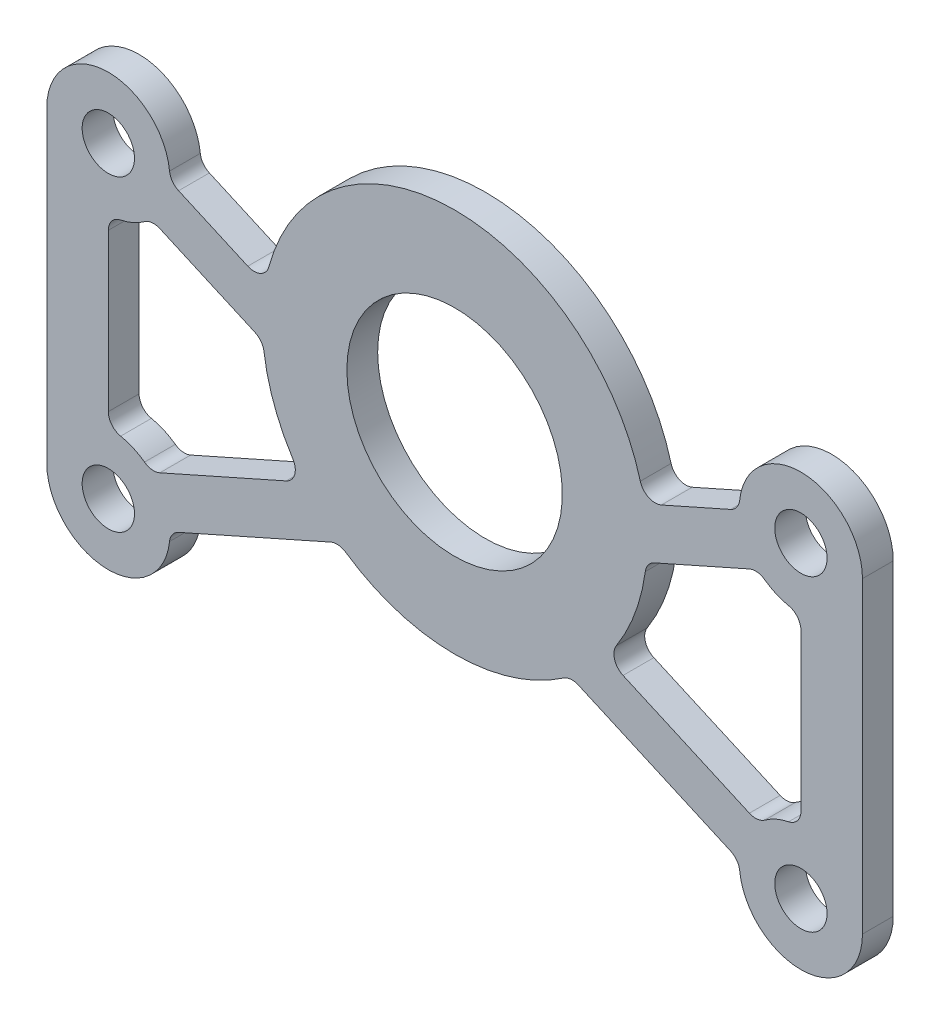
from build123d import *

# Parameters (mm, degrees)
SKETCH_1_R          = 12.5
EXTRUDE_1_DEPTH     = 2
SKETCH_1_R_2        = 4
EXTRUDE_1_2_DEPTH   = 2
EXTRUDE_1_3_DEPTH   = 2
EXTRUDE_1_4_DEPTH   = 2
EXTRUDE_1_5_DEPTH   = 2
EXTRUDE_2_DEPTH     = 2
EXTRUDE_3_DEPTH     = 2
FILLET_1_R          = 1
SKETCH_5_R          = 7
CUT_EXTRUDE_1_DEPTH = 33.668792448
HOLE_WIZARD_M3_1_D  = 3.4


with BuildPart() as part:
    # ｽｹｯﾁ1 → ﾎﾞｽ - 押し出し1 (new body)
    with BuildSketch(Plane.XY):
        Circle(SKETCH_1_R)
    extrude(amount=EXTRUDE_1_DEPTH)



with BuildPart() as body_2:
    # ｽｹｯﾁ1 → Extrude 1 2 (new body)
    with BuildSketch(Plane.XY):
        with Locations((-22.5, 5)):
            Circle(SKETCH_1_R_2)
    extrude(amount=EXTRUDE_1_2_DEPTH)



with BuildPart() as body_3:
    # ｽｹｯﾁ1 → Extrude 1 3 (new body)
    with BuildSketch(Plane.XY):
        with Locations((-22.5, -15)):
            Circle(SKETCH_1_R_2)
    extrude(amount=EXTRUDE_1_3_DEPTH)


with BuildPart() as body_4:
    # ｽｹｯﾁ1 → Extrude 1 4 (new body)
    with BuildSketch(Plane.XY):
        with Locations((22.5, -15)):
            Circle(SKETCH_1_R_2)
    extrude(amount=EXTRUDE_1_4_DEPTH)


with BuildPart() as body_5:
    # ｽｹｯﾁ1 → Extrude 1 5 (new body)
    with BuildSketch(Plane.XY):
        with Locations((22.5, 5)):
            Circle(SKETCH_1_R_2)
    extrude(amount=EXTRUDE_1_5_DEPTH)


with BuildPart() as body_2_1:
    add(body_2.part)

    add(body_3.part)  # ﾎﾞｽ - 押し出し2 merges body 3

    add(body_4.part)  # ﾎﾞｽ - 押し出し2 merges body 4

    add(body_5.part)  # ﾎﾞｽ - 押し出し2 merges body 5
    # ｽｹｯﾁ2 → ﾎﾞｽ - 押し出し2 (add)
    with BuildSketch(Plane.XY.offset(2)):
        with BuildLine():
            Line((-26.5, 5), (-26.5, -15))
            ThreePointArc((-26.5, -15), (-25.328427125, -12.171572875), (-22.5, -11))
            Line((-22.5, -11), (-22.5, 1))
            ThreePointArc((-22.5, 1), (-25.328427125, 2.171572875), (-26.5, 5))
        make_face()
        with BuildLine():
            ThreePointArc((22.5, -11), (25.328427125, -12.171572875), (26.5, -15))
            Line((26.5, -15), (26.5, 5))
            ThreePointArc((26.5, 5), (25.328427125, 2.171572875), (22.5, 1))
            Line((22.5, 1), (22.5, -11))
        make_face()
    extrude(amount=-EXTRUDE_2_DEPTH)


with BuildPart() as part_1:
    add(part.part)

    add(body_2_1.part)  # ﾎﾞｽ - 押し出し3 merges body 2
    # ｽｹｯﾁ3 → ﾎﾞｽ - 押し出し3 (add, through all)
    with BuildSketch(Plane.XY.offset(2)):
        with BuildLine():
            ThreePointArc((-7.521060552, -9.984169879), (-8.74698669, -8.929738174), (-9.82653887, -7.725874309))
            Line((-9.82653887, -7.725874309), (-23.109207699, -13.629282677))
            ThreePointArc((-23.109207699, -13.629282677), (-23.870717323, -15.609207699), (-21.890792301, -16.370717323))
            Line((-21.890792301, -16.370717323), (-7.521060552, -9.984169879))
        make_face()
        with BuildLine():
            Line((23.109207699, -13.629282677), (9.82653887, -7.725874309))
            ThreePointArc((9.82653887, -7.725874309), (8.74698669, -8.929738174), (7.521060552, -9.984169879))
            Line((7.521060552, -9.984169879), (21.890792301, -16.370717323))
            ThreePointArc((21.890792301, -16.370717323), (23.870717323, -15.609207699), (23.109207699, -13.629282677))
        make_face()
        with BuildLine():
            Line((-12.319463678, 2.116793491), (-21.890792301, 6.370717323))
            ThreePointArc((-21.890792301, 6.370717323), (-23.870717323, 5.609207699), (-23.109207699, 3.629282677))
            Line((-23.109207699, 3.629282677), (-12.450816156, -1.107780231))
            ThreePointArc((-12.450816156, -1.107780231), (-12.489642096, 0.508763509), (-12.319463678, 2.116793491))
        make_face()
        with BuildLine():
            Line((21.890792301, 6.370717323), (12.319463678, 2.116793491))
            ThreePointArc((12.319463678, 2.116793491), (12.454784141, 1.06223915), (12.5, 0))
            ThreePointArc((12.5, 0), (12.487697986, -0.55443577), (12.450816156, -1.107780231))
            Line((12.450816156, -1.107780231), (23.109207699, 3.629282677))
            ThreePointArc((23.109207699, 3.629282677), (23.870717323, 5.609207699), (21.890792301, 6.370717323))
        make_face()
    extrude(amount=-EXTRUDE_3_DEPTH)

    # ﾌｨﾚｯﾄ1
    fillet_1_edges = [part_1.edges().sort_by_distance(p)[0] for p in [
        (12.319463678, 2.116793491, 1),
        (12.450816156, -1.107780231, 1),
        (-18.502288389, -14.864715584, 1),
        (-19.720703787, -12.123280938, 1),
        (-22.5, -11, 1),
        (-22.5, 1, 1),
        (7.521060552, -9.984169879, 1),
        (9.82653887, -7.725874309, 1),
        (19.720703787, -12.123280938, 1),
        (18.502288389, -14.864715584, 1),
        (22.5, -11, 1),
        (22.5, 1, 1),
        (-19.720703787, 2.123280938, 1),
        (-18.502288389, 4.864715584, 1),
        (-12.450816156, -1.107780231, 1),
        (-12.319463678, 2.116793491, 1),
        (-9.82653887, -7.725874309, 1),
        (-7.521060552, -9.984169879, 1),
        (18.502288389, 4.864715584, 1),
        (19.720703787, 2.123280938, 1),
    ]]
    fillet(fillet_1_edges, radius=FILLET_1_R)

    # ｽｹｯﾁ5 → ｶｯﾄ - 押し出し1 (cut, through all)
    with BuildSketch(Plane(origin=(0, 0, 0), x_dir=(-1, 0, 0), z_dir=(0, 0, -1))):
        Circle(SKETCH_5_R)
    extrude(amount=-CUT_EXTRUDE_1_DEPTH, mode=Mode.SUBTRACT)

    # M3 すきま穴1 (through all)
    with Locations(Plane.XY.offset(2)):
        with Locations((-22.5, 5), (-22.5, -15), (22.5, -15), (22.5, 5)):
            Hole(HOLE_WIZARD_M3_1_D / 2)


solid = part_1.part
